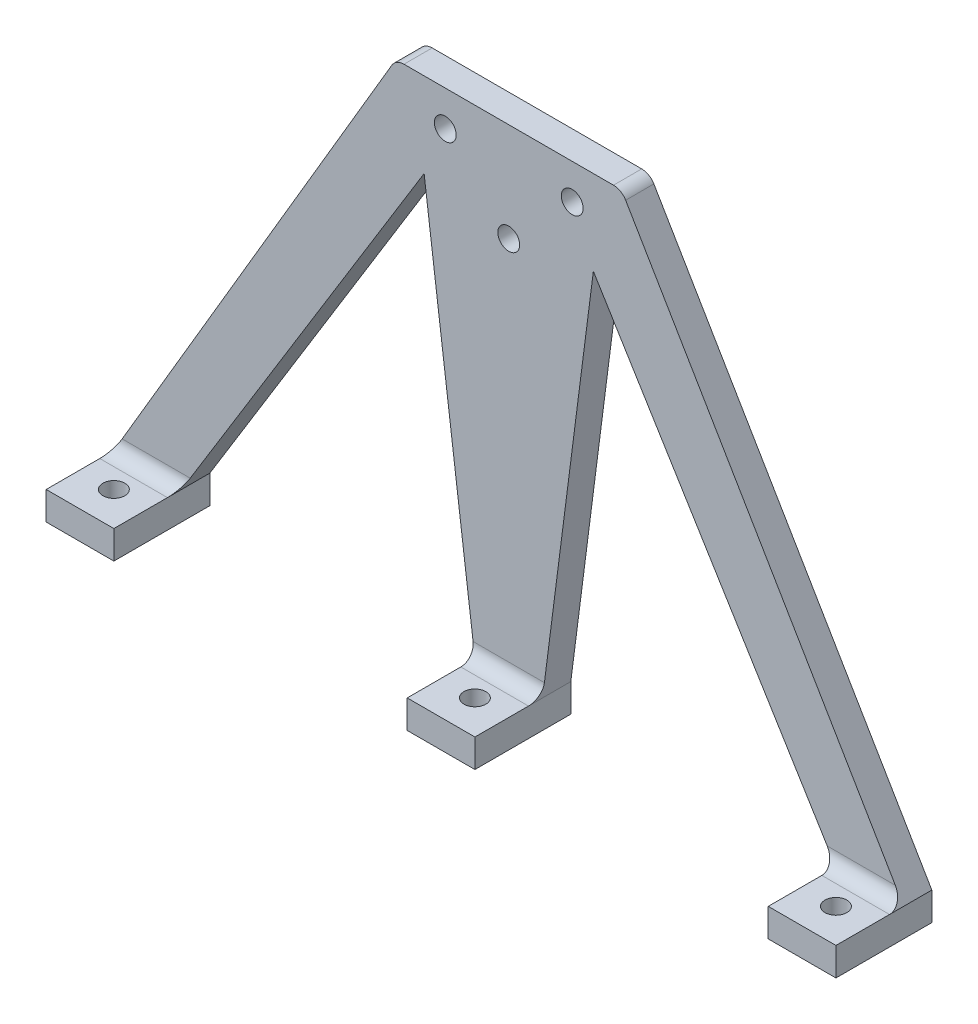
from build123d import *

# Parameters (mm, degrees)
SKETCH1_W           = 112
SKETCH1_H           = 72
BOSS_EXTRUDE1_DEPTH = 4
SKETCH2_W           = 9.6
SKETCH2_H           = 4
BOSS_EXTRUDE2_DEPTH = 9.6
SKETCH3_R           = 1.55
CUT_EXTRUDE1_DEPTH  = 9.6
SKETCH4_R           = 1.55
CUT_EXTRUDE2_DEPTH  = 9.6
CUT_EXTRUDE4_DEPTH  = 9.6
CUT_EXTRUDE5_DEPTH  = 9.6
FILLET1_R           = 2
FILLET2_R           = 2


with BuildPart() as part:
    # Sketch1 → Boss-Extrude1 (new body)
    with BuildSketch(Plane.XY):
        with Locations((56, -36)):
            Rectangle(SKETCH1_W, SKETCH1_H)
    extrude(amount=BOSS_EXTRUDE1_DEPTH)

    # Sketch2 → Boss-Extrude2 (add)
    with BuildSketch(Plane.XY.offset(4)):
        with Locations((4.8, -70)):
            Rectangle(SKETCH2_W, SKETCH2_H)
        with Locations((107.2, -70)):
            Rectangle(SKETCH2_W, SKETCH2_H)
        with Locations((56, -70)):
            Rectangle(SKETCH2_W, SKETCH2_H)
    extrude(amount=BOSS_EXTRUDE2_DEPTH)

    # Sketch3 → Cut-Extrude1 (cut)
    with BuildSketch(Plane(origin=(0, -68, 0), x_dir=(1, 0, 0), z_dir=(0, 1, 0))):
        with Locations(Location((4.8, -8.8, 0), (0, 0, 270))):
            Circle(SKETCH3_R)
        with Locations(Location((56, -8.8, 0), (0, 0, 270))):
            Circle(SKETCH3_R)
        with Locations(Location((107.2, -8.8, 0), (0, 0, 270))):
            Circle(SKETCH3_R)
    extrude(amount=-CUT_EXTRUDE1_DEPTH, mode=Mode.SUBTRACT)

    # Sketch4 → Cut-Extrude2 (cut)
    with BuildSketch(Plane.XY.offset(4)):
        with Locations((47, -5)):
            Circle(SKETCH4_R)
        with Locations((65, -5)):
            Circle(SKETCH4_R)
        with Locations((56, -14)):
            Circle(SKETCH4_R)
    extrude(amount=-CUT_EXTRUDE2_DEPTH, mode=Mode.SUBTRACT)

    # Sketch5 → Cut-Extrude4 (cut)
    with BuildSketch(Plane.XY.offset(4)):
        Polygon((0, -68), (0, 0), (40, 0), align=None)
        Polygon((72, 0), (112, -68), (112, 0), align=None)
    extrude(amount=-CUT_EXTRUDE4_DEPTH, mode=Mode.SUBTRACT)

    # Sketch6 → Cut-Extrude5 (cut)
    with BuildSketch(Plane.XY.offset(4)):
        Polygon((9.6, -68), (44, -12), (51.2, -68), (51.2, -72), (9.6, -72), align=None)
        Polygon((102.4, -72), (102.4, -68), (68, -12), (60.8, -68), (60.8, -72), align=None)
    extrude(amount=-CUT_EXTRUDE5_DEPTH, mode=Mode.SUBTRACT)

    # Fillet1
    fillet1_edges = [part.edges().sort_by_distance(p)[0] for p in [
        (4.8, -68, 4),
        (107.2, -68, 4),
        (56, -68, 4),
    ]]
    fillet(fillet1_edges, radius=FILLET1_R)

    # Fillet2
    fillet2_edges = [part.edges().sort_by_distance(p)[0] for p in [
        (40, 0, 2),
        (72, 0, 2),
    ]]
    fillet(fillet2_edges, radius=FILLET2_R)


solid = part.part
